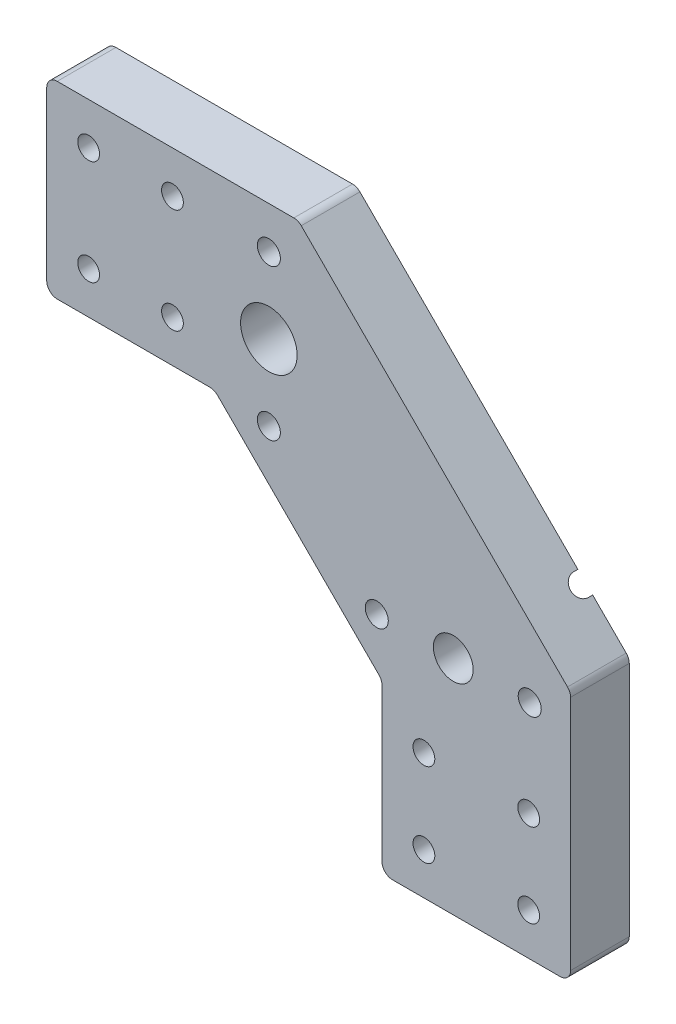
from build123d import *

# Parameters (mm, degrees)
SKETCH_1_R                = 6.75
SKETCH_1_R_2              = 4.75
EXTRUDE_2_DEPTH           = 14
SKETCH_7_R                = 2.75
CUT_EXTRUDE_6_DEPTH       = 122.020659393
CUT_EXTRUDE_7_DEPTH       = 4.2
SKETCH_11_R               = 2.6
CUT_EXTRUDE_10_DEPTH      = 122.020659393
SKETCH_12_R               = 8.5
CUT_EXTRUDE_11_DEPTH      = 7
CUT_EXTRUDE_12_REACH      = 133.562
CUT_EXTRUDE_12_END_RADIUS = 8.5
FILLET_1_R                = 2.5


with BuildPart() as part:
    # Эскиз1 → Бобышка-Вытянуть2 (new body)
    with BuildSketch(Plane.XY):
        Polygon((40, 0), (40, -40), (85, -40), (85, 20), (20, 85), (-40, 85), (-40, 40), (0, 40), align=None)
        with Locations((13, 57)):
            Circle(SKETCH_1_R, mode=Mode.SUBTRACT)
        with Locations((57, 13)):
            Circle(SKETCH_1_R_2, mode=Mode.SUBTRACT)
    extrude(amount=EXTRUDE_2_DEPTH)

    # Эскиз7 → Вырез-Вытянуть6 (cut, through all)
    with BuildSketch(Plane.XY.offset(14)):
        with Locations((13, 39)):
            Circle(SKETCH_7_R)
        with Locations((13, 75)):
            Circle(SKETCH_7_R)
        with Locations((38.75, 13)):
            Circle(SKETCH_7_R)
        with Locations((75.25, 13)):
            Circle(SKETCH_7_R)
    extrude(amount=-CUT_EXTRUDE_6_DEPTH, mode=Mode.SUBTRACT)

    # Эскиз8 → Вырез-Вытянуть7 (cut)
    with BuildSketch(Plane(origin=(0, 0, 0), x_dir=(-1, 0, 0), z_dir=(0, 0, -1))):
        Polygon((-17.734272207, 75), (-15.367136104, 70.9), (-10.632863896, 70.9), (-8.265727793, 75), (-10.632863896, 79.1), (-15.367136104, 79.1), align=None)
        Polygon((-17.734272207, 39), (-15.367136104, 34.9), (-10.632863896, 34.9), (-8.265727793, 39), (-10.632863896, 43.1), (-15.367136104, 43.1), align=None)
        Polygon((-34.015727793, 13), (-36.382863896, 17.1), (-41.117136104, 17.1), (-43.484272207, 13), (-41.117136104, 8.9), (-36.382863896, 8.9), align=None)
        Polygon((-70.515727793, 13), (-72.882863896, 17.1), (-77.617136104, 17.1), (-79.984272207, 13), (-77.617136104, 8.9), (-72.882863896, 8.9), align=None)
    extrude(amount=-CUT_EXTRUDE_7_DEPTH, mode=Mode.SUBTRACT)

    # Эскиз11 → Вырез-Вытянуть10 (cut, through all)
    with BuildSketch(Plane.XY.offset(14)):
        with Locations((50, -30)):
            Circle(SKETCH_11_R)
        with Locations((75, -30)):
            Circle(SKETCH_11_R)
        with Locations((75, -10)):
            Circle(SKETCH_11_R)
        with Locations((50, -10)):
            Circle(SKETCH_11_R)
        with Locations(Location((-10, 50, 0), (0, 0, 180))):
            Circle(SKETCH_11_R)
        with Locations(Location((-30, 50, 0), (0, 0, 180))):
            Circle(SKETCH_11_R)
        with Locations(Location((-30, 75, 0), (0, 0, 180))):
            Circle(SKETCH_11_R)
        with Locations(Location((-10, 75, 0), (0, 0, 180))):
            Circle(SKETCH_11_R)
    extrude(amount=-CUT_EXTRUDE_10_DEPTH, mode=Mode.SUBTRACT)

    # Эскиз12 → Вырез-Вытянуть11 (cut)
    with BuildSketch(Plane(origin=(0, 0, 0), x_dir=(-1, 0, 0), z_dir=(0, 0, -1))):
        with Locations((-57, 13)):
            Circle(SKETCH_12_R)
    extrude(amount=-CUT_EXTRUDE_11_DEPTH, mode=Mode.SUBTRACT)

    # Вырез-Вытянуть12: up to this cylinder (the profile starts outside it)
    cut_extrude_12_end = Plane(origin=(57, 13, 1.534279), z_dir=(0, 0, -1)) * Cylinder(CUT_EXTRUDE_12_END_RADIUS, 285.124, mode=Mode.PRIVATE)
    # Эскиз13 → Вырез-Вытянуть12 (cut, up to the surface)
    with BuildSketch(Plane(origin=(52.5, 52.5, 0), x_dir=(0, 0, -1), z_dir=(0.7071067811865477, 0.7071067811865474, 0)), mode=Mode.PRIVATE) as cut_extrude_12_sk1:
        with BuildLine():
            Line((-1, -33.612698372), (0, -33.612698372))
            Line((0, -33.612698372), (0, -28.612698372))
            Line((0, -28.612698372), (-1, -28.612698372))
            ThreePointArc((-1, -28.612698372), (-3.5, -31.112698372), (-1, -33.612698372))
        make_face()
    cut_extrude_12_tool1 = extrude(cut_extrude_12_sk1.sketch, amount=-CUT_EXTRUDE_12_REACH, mode=Mode.PRIVATE) - cut_extrude_12_end
    add(cut_extrude_12_tool1.solids().sort_by_distance((74.5, 30.5, 1.534279))[0], mode=Mode.SUBTRACT)

    # Скругление1
    fillet_1_edges = [part.edges().sort_by_distance(p)[0] for p in [
        (0, 40, 7),
        (-40, 40, 7),
        (-40, 85, 7),
        (20, 85, 7),
        (85, 20, 7),
        (85, -40, 7),
        (40, -40, 7),
        (40, 0, 7),
    ]]
    fillet(fillet_1_edges, radius=FILLET_1_R)


solid = part.part
